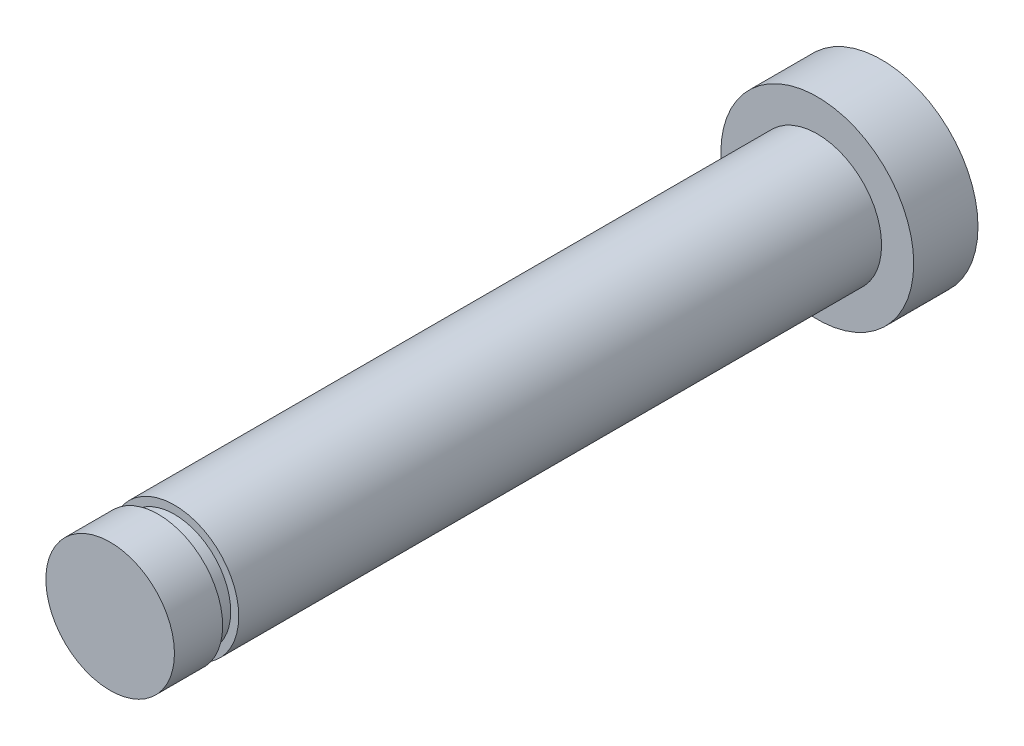
from build123d import *

# Parameters (mm, degrees)
SKETCH_1_R      = 6
EXTRUDE_1_DEPTH = 4
SKETCH_2_R      = 4
EXTRUDE_2_DEPTH = 40
SKETCH_3_R      = 3.5
EXTRUDE_3_DEPTH = 1
SKETCH_4_R      = 4
EXTRUDE_4_DEPTH = 3


with BuildPart() as part:
    # 草图1 → 凸台-拉伸1 (new body)
    with BuildSketch(Plane.XY):
        Circle(SKETCH_1_R)
    extrude(amount=EXTRUDE_1_DEPTH)

    # 草图2 → 凸台-拉伸2 (add)
    with BuildSketch(Plane.XY.offset(4)):
        Circle(SKETCH_2_R)
    extrude(amount=EXTRUDE_2_DEPTH)

    # 草图3 → 凸台-拉伸3 (add)
    with BuildSketch(Plane.XY.offset(44)):
        Circle(SKETCH_3_R)
    extrude(amount=EXTRUDE_3_DEPTH)

    # 草图4 → 凸台-拉伸4 (add)
    with BuildSketch(Plane.XY.offset(45)):
        Circle(SKETCH_4_R)
    extrude(amount=EXTRUDE_4_DEPTH)


solid = part.part
